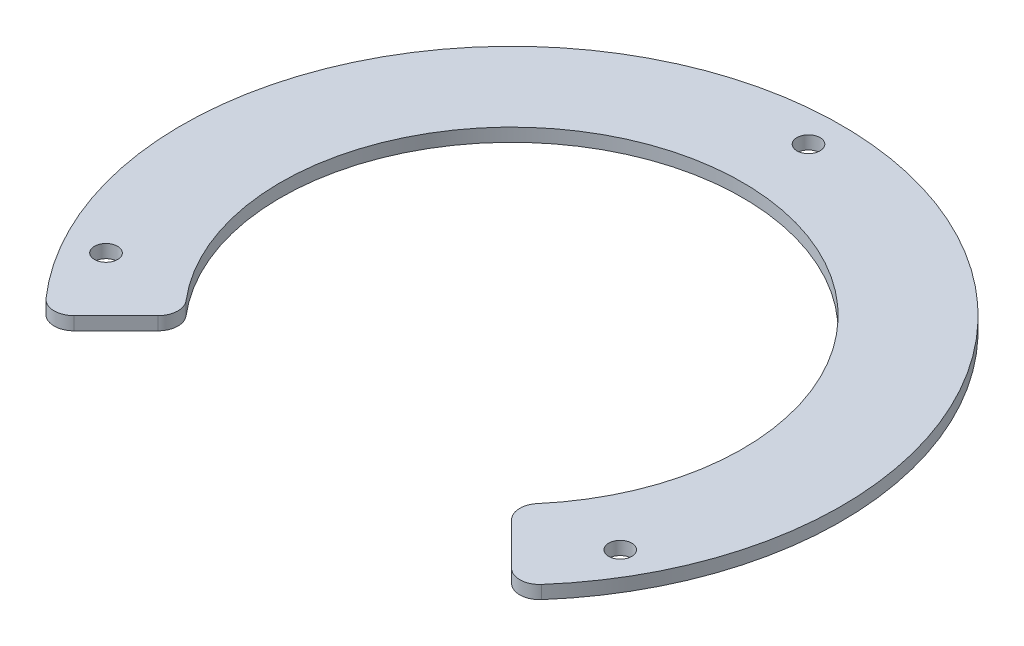
from build123d import *

# Parameters (mm, degrees)
SKETCH1_R           = 50
SKETCH1_R_2         = 35
SKETCH1_R_3         = 1.75
BOSS_EXTRUDE1_DEPTH = 2
CUT_EXTRUDE1_DEPTH  = 14
FILLET1_R           = 3


with BuildPart() as part:
    # Sketch1 → Boss-Extrude1 (new body)
    with BuildSketch(Plane(origin=(0, 0, 0), x_dir=(1, 0, 0), z_dir=(0, 1, 0))):
        with Locations(Location((0, 0, 0), (0, 0, 270))):
            Circle(SKETCH1_R)
        with Locations(Location((0, 0, 0), (0, 0, 270))):
            Circle(SKETCH1_R_2, mode=Mode.SUBTRACT)
        with Locations(Location((0, 45, 0), (0, 0, 270))):
            Circle(SKETCH1_R_3, mode=Mode.SUBTRACT)
        with Locations(Location((38.97114317, -22.5, 0), (0, 0, 270))):
            Circle(SKETCH1_R_3, mode=Mode.SUBTRACT)
        with Locations(Location((-38.97114317, -22.5, 0), (0, 0, 270))):
            Circle(SKETCH1_R_3, mode=Mode.SUBTRACT)
    extrude(amount=BOSS_EXTRUDE1_DEPTH)

    # Sketch2 → Cut-Extrude1 (cut)
    with BuildSketch(Plane(origin=(0, 2, 0), x_dir=(1, 0, 0), z_dir=(0, 1, 0))):
        Polygon((0, 0), (-50, -50), (50, -50), align=None)
    extrude(amount=-CUT_EXTRUDE1_DEPTH, mode=Mode.SUBTRACT)

    # Fillet1
    fillet1_edges = [part.edges().sort_by_distance(p)[0] for p in [
        (-24.748737342, 1, 24.748737342),
        (24.748737342, 1, 24.748737342),
        (35.355339059, 1, 35.355339059),
        (-35.355339059, 1, 35.355339059),
    ]]
    fillet(fillet1_edges, radius=FILLET1_R)


solid = part.part
